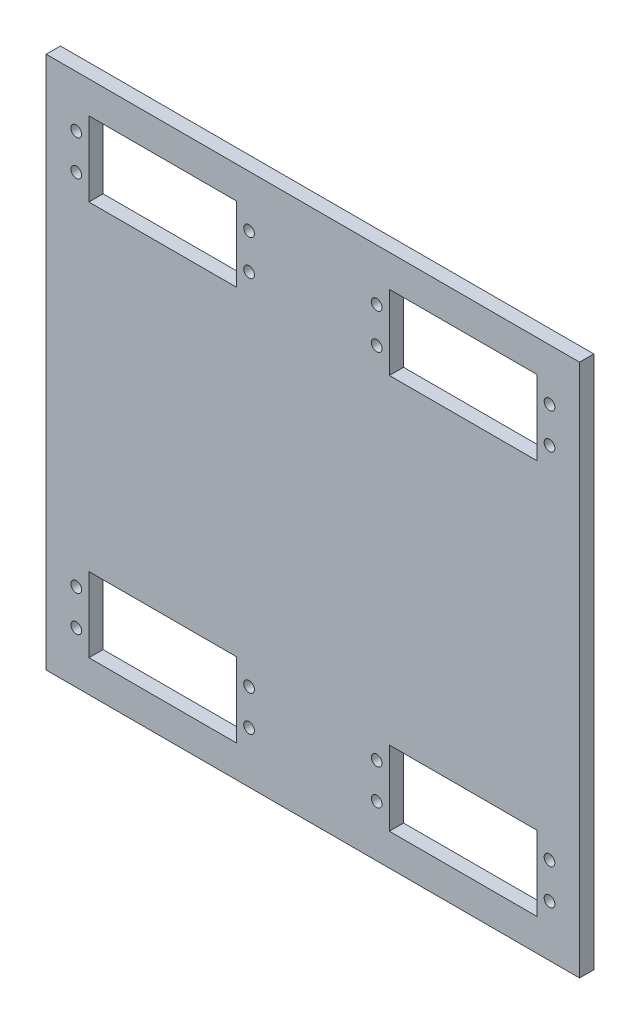
from build123d import *

# Parameters (mm, degrees)
ESBO_O1_W                = 150
ESBO_O1_H                = 150
ESBO_O1_R                = 1.5
ESBO_O1_W_2              = 41.5
ESBO_O1_H_2              = 21
RESSALTO_EXTRUS_O1_DEPTH = 4


with BuildPart() as part:
    # Esboço1 → Ressalto-extrusão1 (new body)
    with BuildSketch(Plane.XY):
        Rectangle(ESBO_O1_W, ESBO_O1_H)
        with Locations((-66.55, 60.5)):
            Circle(ESBO_O1_R, mode=Mode.SUBTRACT)
        with Locations((-66.55, 50.5)):
            Circle(ESBO_O1_R, mode=Mode.SUBTRACT)
        with Locations(Location((-17.95, 60.5, 0), (0, 0, 180))):
            Circle(ESBO_O1_R, mode=Mode.SUBTRACT)
        with Locations(Location((-17.95, 50.5, 0), (0, 0, 180))):
            Circle(ESBO_O1_R, mode=Mode.SUBTRACT)
        with Locations((17.95, 50.5)):
            Circle(ESBO_O1_R, mode=Mode.SUBTRACT)
        with Locations((17.95, 60.5)):
            Circle(ESBO_O1_R, mode=Mode.SUBTRACT)
        with Locations(Location((66.55, 50.5, 0), (0, 0, 180))):
            Circle(ESBO_O1_R, mode=Mode.SUBTRACT)
        with Locations(Location((66.55, 60.5, 0), (0, 0, 180))):
            Circle(ESBO_O1_R, mode=Mode.SUBTRACT)
        with Locations((66.55, -60.5)):
            Circle(ESBO_O1_R, mode=Mode.SUBTRACT)
        with Locations((66.55, -50.5)):
            Circle(ESBO_O1_R, mode=Mode.SUBTRACT)
        with Locations(Location((17.95, -60.5, 0), (0, 0, 180))):
            Circle(ESBO_O1_R, mode=Mode.SUBTRACT)
        with Locations(Location((17.95, -50.5, 0), (0, 0, 180))):
            Circle(ESBO_O1_R, mode=Mode.SUBTRACT)
        with Locations((-17.95, -50.5)):
            Circle(ESBO_O1_R, mode=Mode.SUBTRACT)
        with Locations((-17.95, -60.5)):
            Circle(ESBO_O1_R, mode=Mode.SUBTRACT)
        with Locations(Location((-66.55, -50.5, 0), (0, 0, 180))):
            Circle(ESBO_O1_R, mode=Mode.SUBTRACT)
        with Locations(Location((-66.55, -60.5, 0), (0, 0, 180))):
            Circle(ESBO_O1_R, mode=Mode.SUBTRACT)
        with Locations((-42.25, 55.5)):
            Rectangle(ESBO_O1_W_2, ESBO_O1_H_2, mode=Mode.SUBTRACT)
        with Locations((42.25, 55.5)):
            Rectangle(ESBO_O1_W_2, ESBO_O1_H_2, mode=Mode.SUBTRACT)
        with Locations((42.25, -55.5)):
            Rectangle(ESBO_O1_W_2, ESBO_O1_H_2, mode=Mode.SUBTRACT)
        with Locations((-42.25, -55.5)):
            Rectangle(ESBO_O1_W_2, ESBO_O1_H_2, mode=Mode.SUBTRACT)
    extrude(amount=RESSALTO_EXTRUS_O1_DEPTH)


solid = part.part
